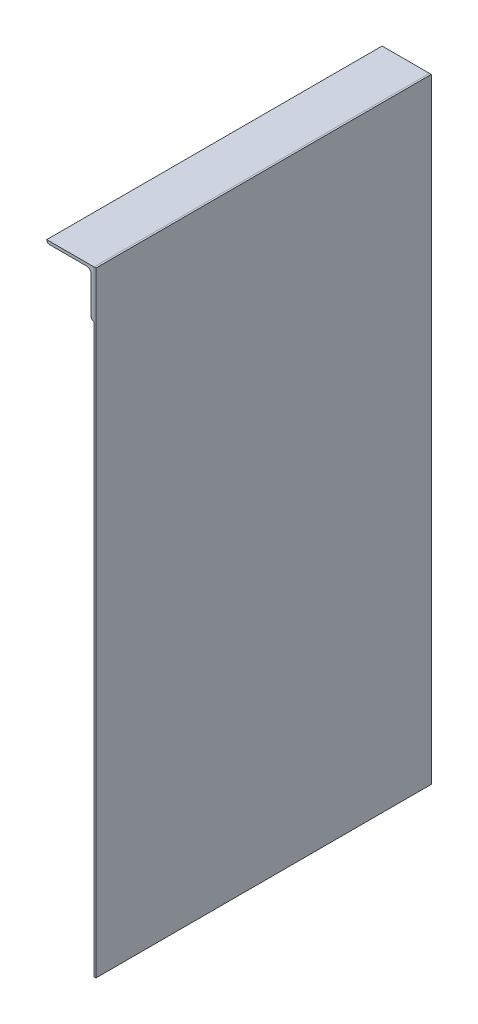
from build123d import *

# Parameters (mm, degrees)
HIERRO_ANGULAR_2_X_2_X_0_125_1_DEPTH        = 732.842048969
HIERRO_ANGULAR_2_X_2_X_0_125_1_2_DEPTH      = 360
HIERRO_ANGULAR_2_X_2_X_0_125_1_2_DEPTH_BACK = 72.842048969
CROQUIS2_W                                  = 360
CROQUIS2_H                                  = 660
SALIENTE_EXTRUIR1_DEPTH                     = 2


with BuildPart() as part:
    # Sketch1 on segment 1 (carried to segment 1) → Hierro angular 2 X 2 X 0.125(1) (new body)
    with BuildSketch(Plane(origin=(0, -660, 0), x_dir=(-1, 0, 0), z_dir=(0, 1, 0))):
        with BuildLine():
            Line((0, 0), (0, 50.8))
            Line((0, 50.8), (0.00508, 50.8))
            ThreePointArc((0.00508, 50.8), (2.246551928, 49.871551928), (3.175, 47.63008))
            Line((3.175, 47.63008), (3.175, 7.9375))
            ThreePointArc((3.175, 7.9375), (4.569903955, 4.569903955), (7.9375, 3.175))
            Line((7.9375, 3.175), (47.63008, 3.175))
            ThreePointArc((47.63008, 3.175), (49.871551928, 2.246551928), (50.8, 0.00508))
            Line((50.8, 0.00508), (50.8, 0))
            Line((50.8, 0), (0, 0))
        make_face()
    extrude(amount=HIERRO_ANGULAR_2_X_2_X_0_125_1_DEPTH)

    # Hierro angular 2 X 2 X 0.125(1) mitre 1
    split(bisect_by=Plane(origin=(0, 0, 0), x_dir=(1, 0, 0), z_dir=(0, -0.707106781, -0.707106781)), keep=Keep.TOP)


with BuildPart() as body_2:
    # Sketch1 → Hierro angular 2 X 2 X 0.125_1 2 (new, two sides: drawn at the far end of the back side and taken through both)
    with BuildSketch(Plane(origin=(0, 0, 0), x_dir=(-1, 0, 0), z_dir=(0, 0, 1)).offset(-HIERRO_ANGULAR_2_X_2_X_0_125_1_2_DEPTH_BACK)):
        with BuildLine():
            Line((0, 0), (0, 50.8))
            Line((0, 50.8), (0.00508, 50.8))
            ThreePointArc((0.00508, 50.8), (2.246551928, 49.871551928), (3.175, 47.63008))
            Line((3.175, 47.63008), (3.175, 7.9375))
            ThreePointArc((3.175, 7.9375), (4.569903955, 4.569903955), (7.9375, 3.175))
            Line((7.9375, 3.175), (47.63008, 3.175))
            ThreePointArc((47.63008, 3.175), (49.871551928, 2.246551928), (50.8, 0.00508))
            Line((50.8, 0.00508), (50.8, 0))
            Line((50.8, 0), (0, 0))
        make_face()
    extrude(amount=HIERRO_ANGULAR_2_X_2_X_0_125_1_2_DEPTH + HIERRO_ANGULAR_2_X_2_X_0_125_1_2_DEPTH_BACK)

    # Hierro angular 2 X 2 X 0.125_1 2 mitre 1
    split(bisect_by=Plane(origin=(0, 0, 0), x_dir=(-1, 0, 0), z_dir=(0, 0.707106781, 0.707106781)), keep=Keep.TOP)


with BuildPart() as body_3:
    # Croquis2 → Saliente-Extruir1 (new body)
    with BuildSketch(Plane(origin=(0, 0, 0), x_dir=(0, 0, -1), z_dir=(1, 0, 0))):
        with Locations((-180, -330)):
            Rectangle(CROQUIS2_W, CROQUIS2_H)
    extrude(amount=SALIENTE_EXTRUIR1_DEPTH)


solid = Compound([part.part, body_2.part, body_3.part])
